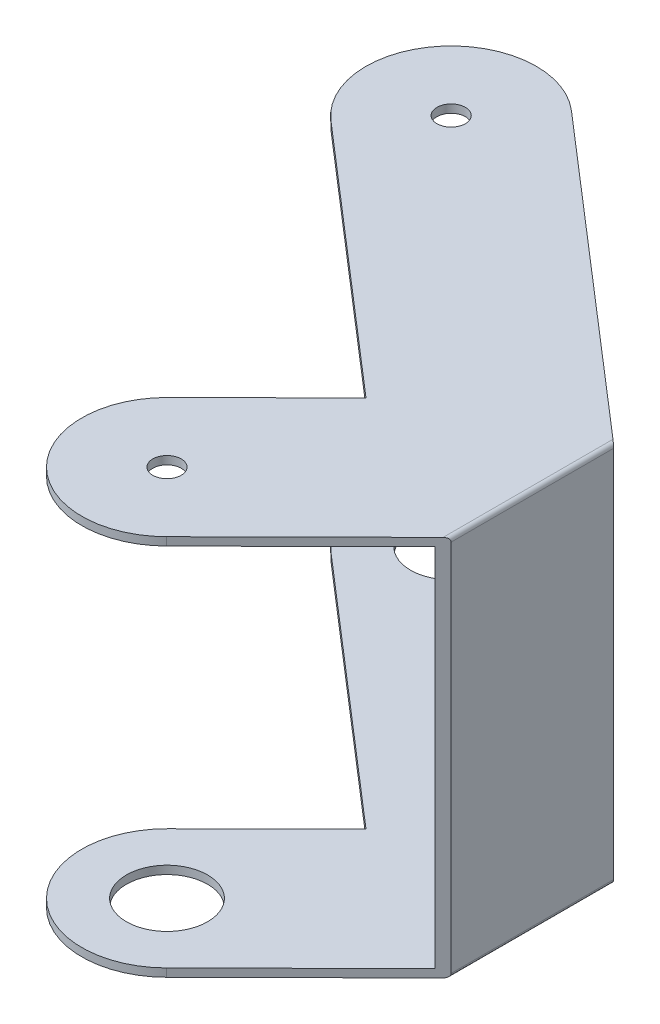
from build123d import *

# Parameters (mm, degrees)
EXTRUDE_1_DEPTH             = 47
SHELL_1_T                   = -1
FILLET_2_R                  = 0.5
HOLE_WIZARD_3_5_3_5_1_D     = 3.5
HOLE_WIZARD_3_5_3_5_1_DEPTH = 1
HOLE_WIZARD_10_0_10_3_D     = 10
HOLE_WIZARD_10_0_10_3_DEPTH = 1


with BuildPart() as part:
    # 草图1 → 凸台-拉伸1 (new body)
    with BuildSketch(Plane(origin=(0, 0, 0), x_dir=(1, 0, 0), z_dir=(0, 1, 0))):
        with BuildLine():
            Line((25, 30), (-13.135780284, 62.94559549))
            ThreePointArc((-13.135780284, 62.94559549), (-27.94559549, 61.864219716), (-26.864219716, 47.05440451))
            Line((-26.864219716, 47.05440451), (4.883538541, 19.627437146))
            Line((4.883538541, 19.627437146), (-7.392601402, 7.456503505))
            ThreePointArc((-7.392601402, 7.456503505), (-7.456503505, -7.392601402), (7.392601402, -7.456503505))
            Line((7.392601402, -7.456503505), (25, 10))
            Line((25, 10), (25, 30))
        make_face()
    extrude(amount=EXTRUDE_1_DEPTH)

    # 抽壳1
    shell_1_openings = [part.faces().sort_by_distance(p)[0] for p in [
        (5.932109858, 23.5, -46.472797745),
        (16.196300701, 23.5, -1.271748248),
        (-7.456503505, 23.5, 7.392601402),
        (-1.25453143, 23.5, -13.541970325),
        (-10.990340588, 23.5, -33.340920828),
        (-27.94559549, 23.5, -61.864219716),
    ]]
    offset(amount=SHELL_1_T, openings=shell_1_openings, kind=Kind.INTERSECTION)

    # 圆角2
    fillet_2_edges = [part.edges().sort_by_distance(p)[0] for p in [
        (25, 47, -20),
        (25, 0, -20),
    ]]
    fillet(fillet_2_edges, radius=FILLET_2_R)

    # Ø3.5 (3.5) 直径槽口1
    with Locations(Plane(origin=(0, 47, 0), x_dir=(1, 0, 0), z_dir=(0, 1, 0))):
        with Locations((0, 0), (-20, 55)):
            Hole(HOLE_WIZARD_3_5_3_5_1_D / 2, depth=HOLE_WIZARD_3_5_3_5_1_DEPTH)

    # Ø10.0 (10) 直径槽口3
    with Locations(Plane(origin=(0, 0, 0), x_dir=(-1, 0, 0), z_dir=(0, -1, 0))):
        with Locations((0, 0), (20, 55)):
            Hole(HOLE_WIZARD_10_0_10_3_D / 2, depth=HOLE_WIZARD_10_0_10_3_DEPTH)


solid = part.part
